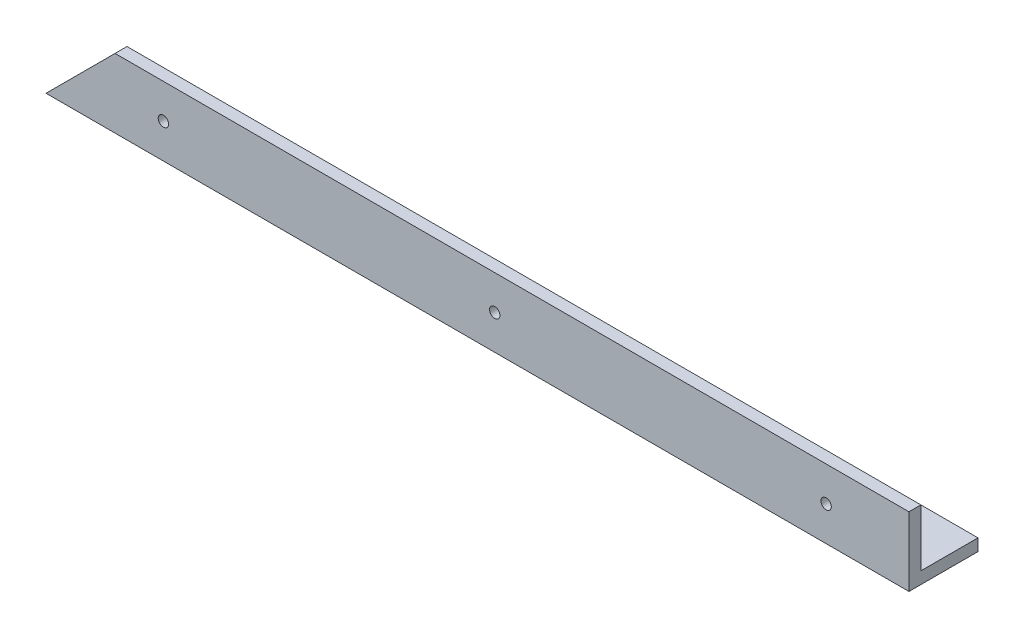
from build123d import *

# Parameters (mm, degrees)
BOSS_EXTRUDE1_DEPTH = 250
SKETCH2_R           = 1.5
CUT_EXTRUDE1_DEPTH  = 252.594912508
SKETCH3_R           = 1.5
CUT_EXTRUDE2_DEPTH  = 252.594912508


with BuildPart() as part:
    # Sketch1 → Boss-Extrude1 (new body)
    with BuildSketch(Plane(origin=(0, 0, 0), x_dir=(0, 0, -1), z_dir=(1, 0, 0))):
        Polygon((0, 0), (20, 0), (20, 3.461178467), (3.461178467, 3.461178467), (3.461178467, 20), (0, 20), align=None)
    extrude(amount=BOSS_EXTRUDE1_DEPTH)

    # Sketch2 → Cut-Extrude1 (cut, through all)
    with BuildSketch(Plane(origin=(0, 0, 0), x_dir=(1, 0, 0), z_dir=(0, 0, -1))):
        with Locations((130, -10)):
            Circle(SKETCH2_R)
        with Locations((34, -10)):
            Circle(SKETCH2_R)
        with Locations((226, -10)):
            Circle(SKETCH2_R)
        Polygon((0, 0), (0, -20), (20, -20), align=None)
    extrude(amount=CUT_EXTRUDE1_DEPTH, mode=Mode.SUBTRACT)

    # Sketch3 → Cut-Extrude2 (cut, through all)
    with BuildSketch(Plane.XZ):
        with Locations(Location((185, -9, 0), (0, 0, 270))):
            Circle(SKETCH3_R)
        with Locations(Location((107, -9, 0), (0, 0, 270))):
            Circle(SKETCH3_R)
        with Locations(Location((29, -9, 0), (0, 0, 270))):
            Circle(SKETCH3_R)
        with BuildLine():
            Line((12, -20), (0, -20))
            Line((0, -20), (0, -8))
            ThreePointArc((0, -8), (3.514718626, -16.485281374), (12, -20))
        make_face()
    extrude(amount=-CUT_EXTRUDE2_DEPTH, mode=Mode.SUBTRACT)


solid = part.part
